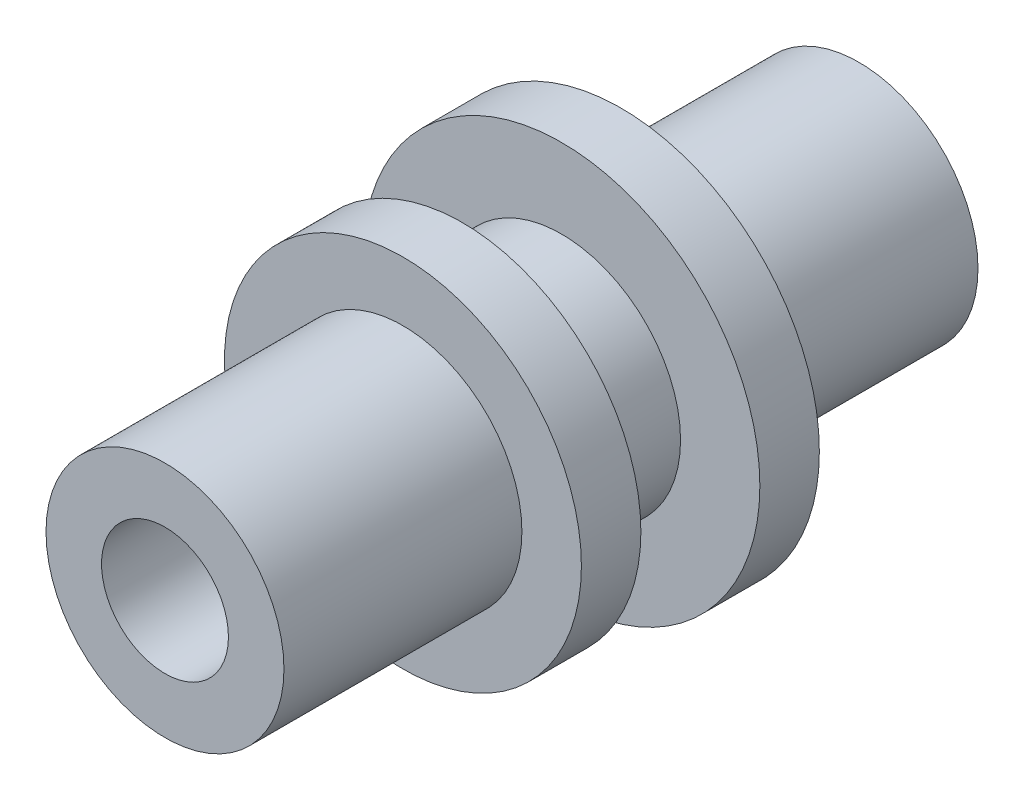
from build123d import *

# Parameters (mm, degrees)
REAR_FLANGE_START    = -3
SKETCH1_R            = 10
REAR_FLANGE_DEPTH    = 3
SKETCH2_R            = 6
THROUGH_BODY_DEPTH   = 5
LOCK_NUT_START       = 5
SKETCH3_R            = 9
LOCK_NUT_DEPTH       = 3
INSIDE_PORT_START    = 8
SKETCH4_R            = 6
INSIDE_PORT_DEPTH    = 12
INSIDE_SOCKET_START  = 20
SKETCH5_R            = 3.2
INSIDE_SOCKET_DEPTH  = 10
OUTSIDE_PORT_START   = -15
SKETCH6_R            = 6
OUTSIDE_PORT_DEPTH   = 12
OUTSIDE_SOCKET_START = -5
SKETCH7_R            = 3.2
OUTSIDE_SOCKET_DEPTH = 10


with BuildPart() as part:
    # Sketch1 → Rear_Flange (new body)
    with BuildSketch(Plane.XY.offset(REAR_FLANGE_START)):
        Circle(SKETCH1_R)
    extrude(amount=REAR_FLANGE_DEPTH)

    # Sketch2 → Through_Body (add)
    with BuildSketch(Plane.XY):
        Circle(SKETCH2_R)
    extrude(amount=THROUGH_BODY_DEPTH)

    # Sketch3 → Lock_Nut (add)
    with BuildSketch(Plane.XY.offset(LOCK_NUT_START)):
        Circle(SKETCH3_R)
    extrude(amount=LOCK_NUT_DEPTH)

    # Sketch4 → Inside_Port (add)
    with BuildSketch(Plane.XY.offset(INSIDE_PORT_START)):
        Circle(SKETCH4_R)
    extrude(amount=INSIDE_PORT_DEPTH)

    # Sketch5 → Inside_Socket (cut)
    with BuildSketch(Plane.XY.offset(INSIDE_SOCKET_START)):
        Circle(SKETCH5_R)
    extrude(amount=-INSIDE_SOCKET_DEPTH, mode=Mode.SUBTRACT)

    # Sketch6 → Outside_Port (add)
    with BuildSketch(Plane.XY.offset(OUTSIDE_PORT_START)):
        Circle(SKETCH6_R)
    extrude(amount=OUTSIDE_PORT_DEPTH)

    # Sketch7 → Outside_Socket (cut)
    with BuildSketch(Plane.XY.offset(OUTSIDE_SOCKET_START)):
        Circle(SKETCH7_R)
    extrude(amount=-OUTSIDE_SOCKET_DEPTH, mode=Mode.SUBTRACT)


solid = part.part
